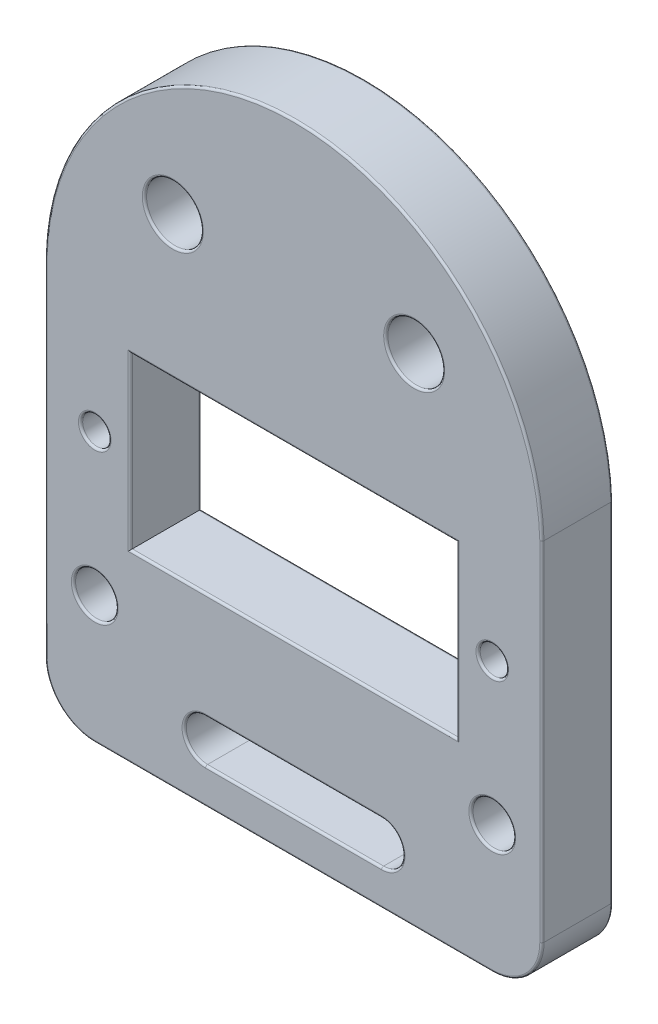
from build123d import *

# Parameters (mm, degrees)
SKETCH1_R           = 1
SKETCH1_R_2         = 1.5
SKETCH1_R_3         = 2
SKETCH1_W           = 23
SKETCH1_H           = 12
BOSS_EXTRUDE1_DEPTH = 5
FILLET1_R           = 3.5
FILLET2_R           = 0.15


with BuildPart() as part:
    # Sketch1 → Boss-Extrude1 (new body)
    with BuildSketch(Plane.XY):
        with BuildLine():
            Line((-17.5, 9), (-17.5, -19))
            Line((-17.5, -19), (17.5, -19))
            Line((17.5, -19), (17.5, 9))
            ThreePointArc((17.5, 9), (0, 26), (-17.5, 9))
        make_face()
        with Locations((-14, 0)):
            Circle(SKETCH1_R, mode=Mode.SUBTRACT)
        with Locations((-14, -10)):
            Circle(SKETCH1_R_2, mode=Mode.SUBTRACT)
        with Locations((-8.5, 16)):
            Circle(SKETCH1_R_3, mode=Mode.SUBTRACT)
        with Locations(Location((14, -10, 0), (0, 0, 180))):
            Circle(SKETCH1_R_2, mode=Mode.SUBTRACT)
        with Locations(Location((14, 0, 0), (0, 0, 180))):
            Circle(SKETCH1_R, mode=Mode.SUBTRACT)
        with Locations(Location((8.5, 16, 0), (0, 0, 180))):
            Circle(SKETCH1_R_3, mode=Mode.SUBTRACT)
        Rectangle(SKETCH1_W, SKETCH1_H, mode=Mode.SUBTRACT)
        with BuildLine():
            Line((-6.2, -13.5), (6.2, -13.5))
            ThreePointArc((6.2, -13.5), (7.7, -15), (6.2, -16.5))
            Line((6.2, -16.5), (-6.2, -16.5))
            ThreePointArc((-6.2, -16.5), (-7.7, -15), (-6.2, -13.5))
        make_face(mode=Mode.SUBTRACT)
    extrude(amount=BOSS_EXTRUDE1_DEPTH)

    # Fillet1
    fillet1_edges = [part.edges().sort_by_distance(p)[0] for p in [
        (17.5, -19, 2.5),
        (-17.5, -19, 2.5),
    ]]
    fillet(fillet1_edges, radius=FILLET1_R)

    # Fillet2
    fillet2_edges = [part.edges().sort_by_distance(p)[0] for p in [
        (11.5, 0, 0),
        (0, 6, 0),
        (-11.5, 0, 0),
        (0, -6, 0),
        (11.5, 0, 5),
        (0, 6, 5),
        (-11.5, 0, 5),
        (0, -6, 5),
        (-15, 0, 0),
        (-15, 0, 5),
        (-15.5, -10, 0),
        (-15.5, -10, 5),
        (-7.7, -15, 0),
        (0, -16.5, 0),
        (7.7, -15, 0),
        (0, -13.5, 0),
        (-7.7, -15, 5),
        (0, -16.5, 5),
        (7.7, -15, 5),
        (0, -13.5, 5),
        (-10.5, 16, 0),
        (-10.5, 16, 5),
        (15.5, -10, 0),
        (0, 26, 5),
        (15.5, -10, 5),
        (15, 0, 0),
        (15, 0, 5),
        (10.5, 16, 0),
        (10.5, 16, 5),
        (-17.5, -3.25, 0),
        (0, 26, 0),
        (0, -19, 0),
        (0, -19, 5),
        (17.5, -3.25, 0),
        (16.474873734, -17.974873734, 0),
        (-16.474873734, -17.974873734, 0),
        (17.5, -3.25, 5),
        (16.474873734, -17.974873734, 5),
        (-16.474873734, -17.974873734, 5),
        (-17.5, -3.25, 5),
    ]]
    fillet(fillet2_edges, radius=FILLET2_R)


solid = part.part
